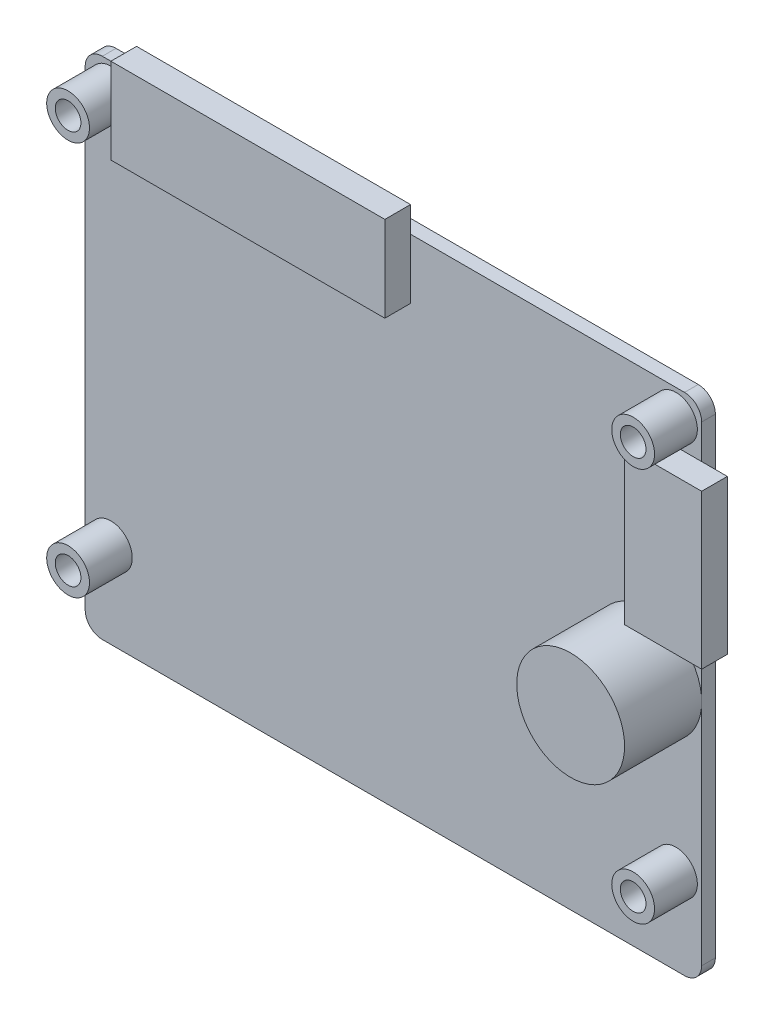
from build123d import *

# Parameters (mm, degrees)
SKETCH_1_R      = 1.5
EXTRUDE_1_DEPTH = 1.6
SKETCH_2_R      = 2.5
SKETCH_2_R_2    = 1.5
EXTRUDE_2_DEPTH = 5
SKETCH_3_R      = 6.3
EXTRUDE_3_DEPTH = 9
EXTRUDE_4_DEPTH = 3
SKETCH_5_W      = 9
SKETCH_5_H      = 6.5
EXTRUDE_5_DEPTH = 5


with BuildPart() as part:
    # 草图1 → 凸台-拉伸1 (new body)
    with BuildSketch(Plane.XY):
        with BuildLine():
            Line((-34, -29.5), (34, -29.5))
            ThreePointArc((34, -29.5), (35.414213562, -28.914213562), (36, -27.5))
            Line((36, -27.5), (36, 27.5))
            ThreePointArc((36, 27.5), (35.414213562, 28.914213562), (34, 29.5))
            Line((34, 29.5), (-34, 29.5))
            ThreePointArc((-34, 29.5), (-35.414213562, 28.914213562), (-36, 27.5))
            Line((-36, 27.5), (-36, -27.5))
            ThreePointArc((-36, -27.5), (-35.414213562, -28.914213562), (-34, -29.5))
        make_face()
        with Locations((-33, 26.5)):
            Circle(SKETCH_1_R, mode=Mode.SUBTRACT)
        with Locations((33, 26.5)):
            Circle(SKETCH_1_R, mode=Mode.SUBTRACT)
        with Locations((33, -19.5)):
            Circle(SKETCH_1_R, mode=Mode.SUBTRACT)
        with Locations((-33, -19.5)):
            Circle(SKETCH_1_R, mode=Mode.SUBTRACT)
    extrude(amount=EXTRUDE_1_DEPTH)

    # 草图2 → 凸台-拉伸2 (add)
    # profile 1 of 4: a face of its own
    with BuildSketch(Plane.XY.offset(1.6)):
        with Locations(Location((33, 26.5, 0), (0, 0, 180))):
            Circle(SKETCH_2_R)
        with Locations((33, 26.5)):
            Circle(SKETCH_2_R_2, mode=Mode.SUBTRACT)
    # profile 2 of 4: a face of its own
    with BuildSketch(Plane.XY.offset(1.6)):
        with Locations(Location((-33, 26.5, 0), (0, 0, 180))):
            Circle(SKETCH_2_R)
        with Locations((-33, 26.5)):
            Circle(SKETCH_2_R_2, mode=Mode.SUBTRACT)
    # profile 3 of 4: a face of its own
    with BuildSketch(Plane.XY.offset(1.6)):
        with Locations(Location((-33, -19.5, 0), (0, 0, 180))):
            Circle(SKETCH_2_R)
        with Locations((-33, -19.5)):
            Circle(SKETCH_2_R_2, mode=Mode.SUBTRACT)
    # profile 4 of 4: a face of its own
    with BuildSketch(Plane.XY.offset(1.6)):
        with Locations(Location((33, -19.5, 0), (0, 0, 180))):
            Circle(SKETCH_2_R)
        with Locations((33, -19.5)):
            Circle(SKETCH_2_R_2, mode=Mode.SUBTRACT)
    extrude(amount=EXTRUDE_2_DEPTH)

    # 草图3 → 凸台-拉伸3 (add)
    with BuildSketch(Plane.XY.offset(1.6)):
        with Locations((29.7, -0.8)):
            Circle(SKETCH_3_R)
    extrude(amount=EXTRUDE_3_DEPTH)

    # 草图4 → 凸台-拉伸4 (add)
    with BuildSketch(Plane.XY.offset(1.6)):
        Polygon((36, 5.5), (30, 5.5), (30, 23.5), (36, 23.5), (39, 23.5), (39, 5.5), align=None)
        Polygon((2, 29.5), (2, 22.5), (-30, 22.5), (-30, 29.5), (-30, 32.5), (2, 32.5), align=None)
    extrude(amount=EXTRUDE_4_DEPTH)

    # 草图5 → 凸台-拉伸5 (add)
    with BuildSketch(Plane(origin=(0, 0, 0), x_dir=(-1, 0, 0), z_dir=(0, 0, -1))):
        with Locations((-21.5, 8.25)):
            Rectangle(SKETCH_5_W, SKETCH_5_H)
    extrude(amount=EXTRUDE_5_DEPTH)


solid = part.part
